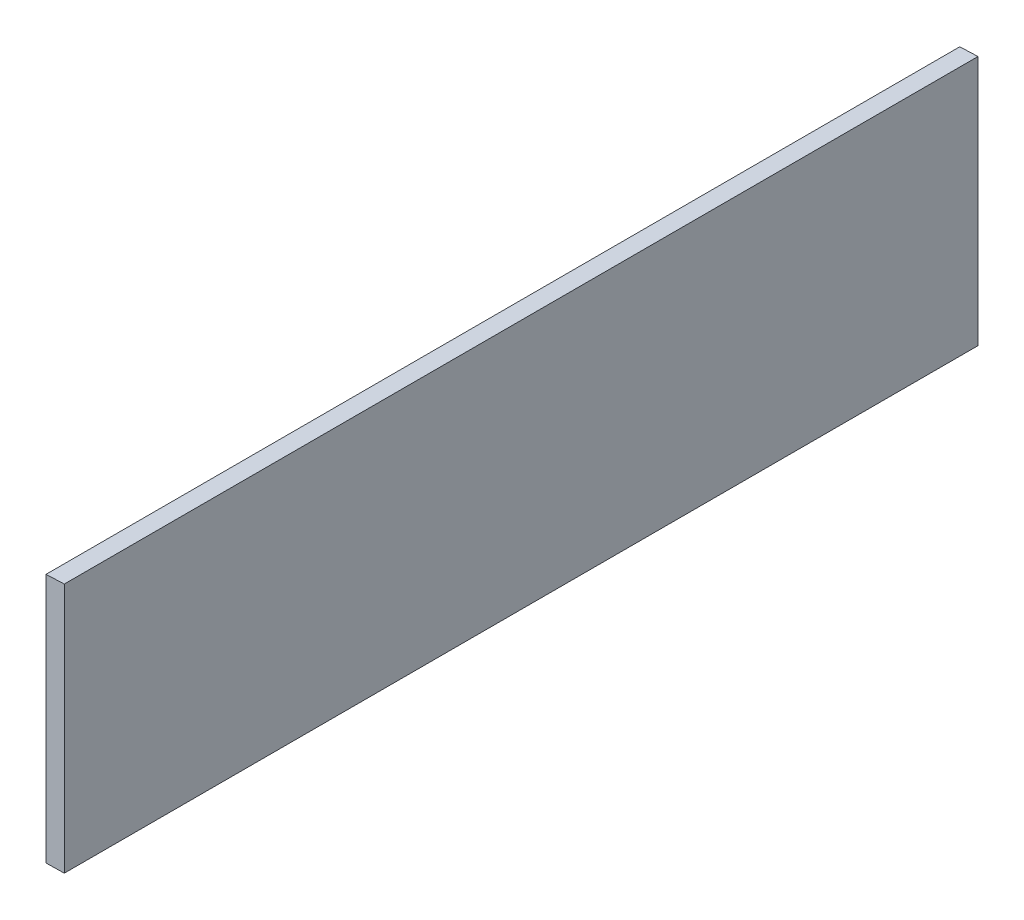
from build123d import *

# Parameters (mm, degrees)
BOSS_EXTRUDE1_DEPTH = 101.6


with BuildPart() as part:
    # Sketch1 → Boss-Extrude1 (new body)
    with BuildSketch(Plane.XY):
        with BuildLine():
            add(Edge.make_bspline(
                [(78.232, 20.905793748), (78.208970607, 20.904925511), (77.531583804, 20.879337738), (76.854248714, 20.852296647), (76.2, 20.824757853)],
                knots=[0.368781876, 0.368781876, 0.368781876, 0.368781876, 0.368893733, 0.372072045, 0.372072045, 0.372072045, 0.372072045], degree=3))
            Line((76.2, 20.824757853), (76.2, -6.975039847))
            add(Edge.make_bspline(
                [(76.2, -6.975039847), (76.877340925, -6.964300237), (77.554674271, -6.953119921), (78.232, -6.941515669)],
                knots=[0.629913027, 0.629913027, 0.629913027, 0.629913027, 0.633201144, 0.633201144, 0.633201144, 0.633201144], degree=3))
            Line((78.232, -6.941515669), (78.232, 20.905793748))
        make_face()
    extrude(amount=BOSS_EXTRUDE1_DEPTH)


solid = part.part
